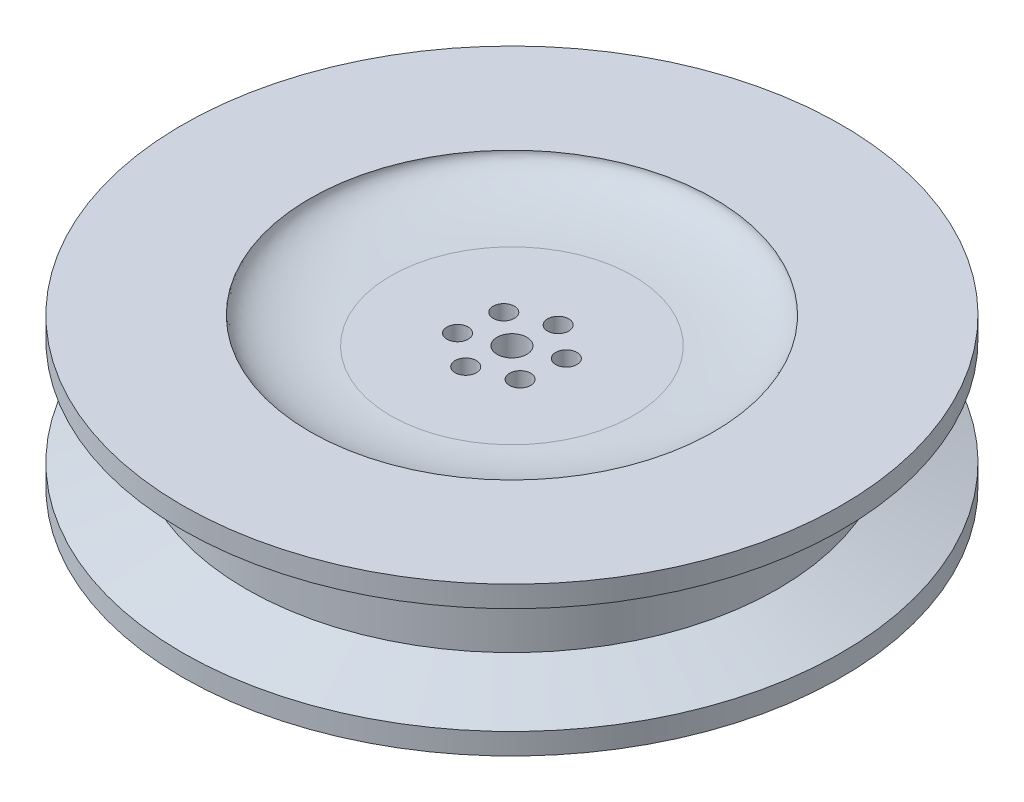
from build123d import *

# Parameters (mm, degrees)
SKETCH3_R          = 1
CUT_EXTRUDE1_DEPTH = 10


with BuildPart() as part:
    # Sketch2 → Revolve1 (revolve)
    with BuildSketch(Plane.XY, mode=Mode.PRIVATE) as revolve1_sk:
        with BuildLine():
            Line((-1.4, 9.635032461), (-1.4, 0.635032461))
            Line((-1.4, 0.635032461), (-11.4, 0.635032461))
            add(Edge.make_bspline(
                [(-11.4, 0.635032461), (-19, 0.635032461), (-19, -1.864967539)],
                knots=[4.71238898, 4.71238898, 4.71238898, 6.283185307, 6.283185307, 6.283185307], degree=2, weights=[1, 0.707106781, 1]))
            Line((-19, -1.864967539), (-31, -1.864967539))
            Line((-31, -1.864967539), (-31, 0.135032461))
            Line((-31, 0.135032461), (-25, 2.320032461))
            Line((-25, 2.320032461), (-25, 7.950032461))
            Line((-25, 7.950032461), (-31, 10.135032461))
            Line((-31, 10.135032461), (-31, 12.135032461))
            Line((-31, 12.135032461), (-19, 12.135032461))
            add(Edge.make_bspline(
                [(-19, 12.135032461), (-19, 9.635032461), (-11.4, 9.635032461)],
                knots=[0, 0, 0, 1.570796327, 1.570796327, 1.570796327], degree=2, weights=[1, 0.707106781, 1]))
            Line((-11.4, 9.635032461), (-1.4, 9.635032461))
        make_face()
    revolve(revolve1_sk.sketch.rotate(Axis((0, 6.223604304, 0), (0, -1, 0)), 270), axis=Axis((0, 6.223604304, 0), (0, -1, 0)))

    # Sketch3 → Cut-Extrude1 (cut)
    with BuildSketch(Plane(origin=(0, 9.635032461, 0), x_dir=(1, 0, 0), z_dir=(0, 1, 0))):
        with Locations(Location((-3.115047488, 2.346588832, 0), (0, 0, 270))):
            Circle(SKETCH3_R)
        with Locations(Location((0.474681797, 3.871004675, 0), (0, 0, 270))):
            Circle(SKETCH3_R)
        with Locations(Location((3.589729285, 1.524415842, 0), (0, 0, 270))):
            Circle(SKETCH3_R)
        with Locations(Location((3.115047488, -2.346588832, 0), (0, 0, 270))):
            Circle(SKETCH3_R)
        with Locations(Location((-0.474681797, -3.871004675, 0), (0, 0, 270))):
            Circle(SKETCH3_R)
        with Locations(Location((-3.589729285, -1.524415842, 0), (0, 0, 270))):
            Circle(SKETCH3_R)
    extrude(amount=-CUT_EXTRUDE1_DEPTH, mode=Mode.SUBTRACT)


solid = part.part
